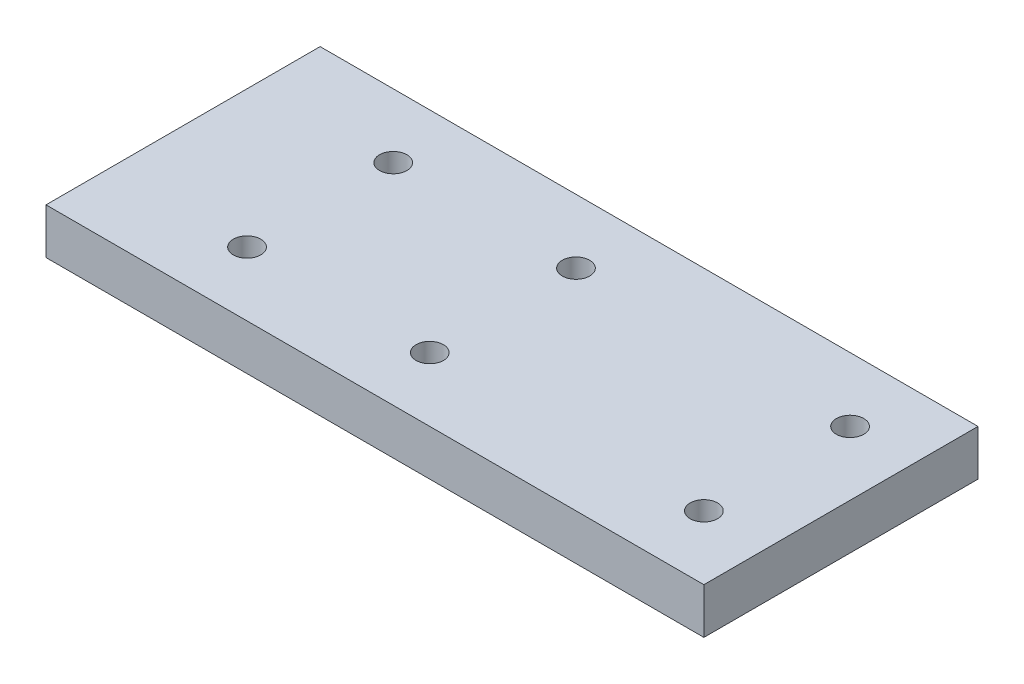
from build123d import *

# Parameters (mm, degrees)
SKETCH1_W           = 72
SKETCH1_H           = 30
SKETCH1_R           = 1.5
BOSS_EXTRUDE1_DEPTH = 5


with BuildPart() as part:
    # Sketch1 → Boss-Extrude1 (new body)
    with BuildSketch(Plane(origin=(0, 0, 0), x_dir=(1, 0, 0), z_dir=(0, 1, 0))):
        with Locations((21, 0)):
            Rectangle(SKETCH1_W, SKETCH1_H)
        with Locations(Location((0, 8, 0), (0, 0, 270))):
            Circle(SKETCH1_R, mode=Mode.SUBTRACT)
        with Locations(Location((20, 8, 0), (0, 0, 270))):
            Circle(SKETCH1_R, mode=Mode.SUBTRACT)
        with Locations(Location((50, 8, 0), (0, 0, 270))):
            Circle(SKETCH1_R, mode=Mode.SUBTRACT)
        with Locations(Location((50, -8, 0), (0, 0, 270))):
            Circle(SKETCH1_R, mode=Mode.SUBTRACT)
        with Locations(Location((20, -8, 0), (0, 0, 270))):
            Circle(SKETCH1_R, mode=Mode.SUBTRACT)
        with Locations(Location((0, -8, 0), (0, 0, 270))):
            Circle(SKETCH1_R, mode=Mode.SUBTRACT)
    extrude(amount=BOSS_EXTRUDE1_DEPTH)


solid = part.part
